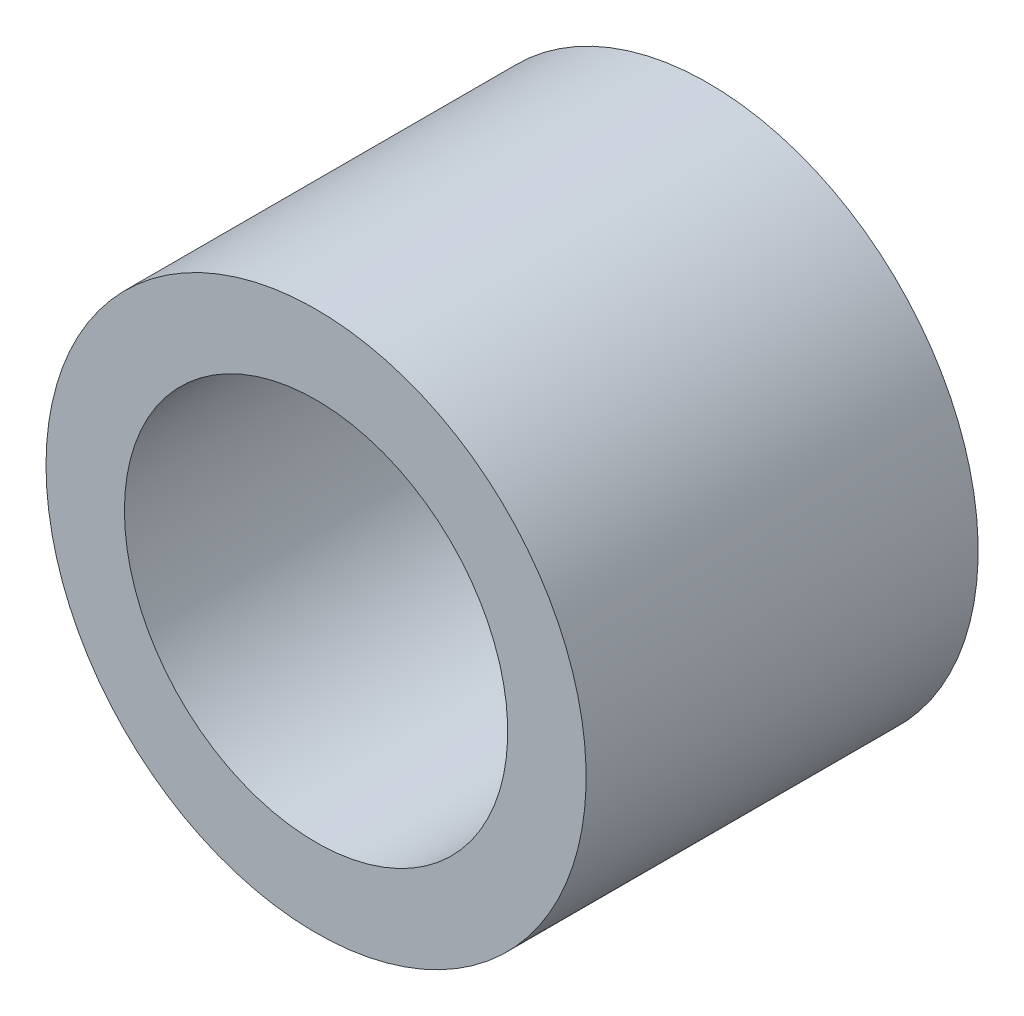
from build123d import *

# Parameters (mm, degrees)
CROQUIS1_R              = 15.5
CROQUIS1_R_2            = 11
SALIENTE_EXTRUIR1_DEPTH = 22.5


with BuildPart() as part:
    # Croquis1 → Saliente-Extruir1 (new body)
    with BuildSketch(Plane.XY):
        with Locations(Location((0, 0, 0), (0, 0, 180))):
            Circle(CROQUIS1_R)
        with Locations(Location((0, 0, 0), (0, 0, 180))):
            Circle(CROQUIS1_R_2, mode=Mode.SUBTRACT)
    extrude(amount=SALIENTE_EXTRUIR1_DEPTH)


solid = part.part
